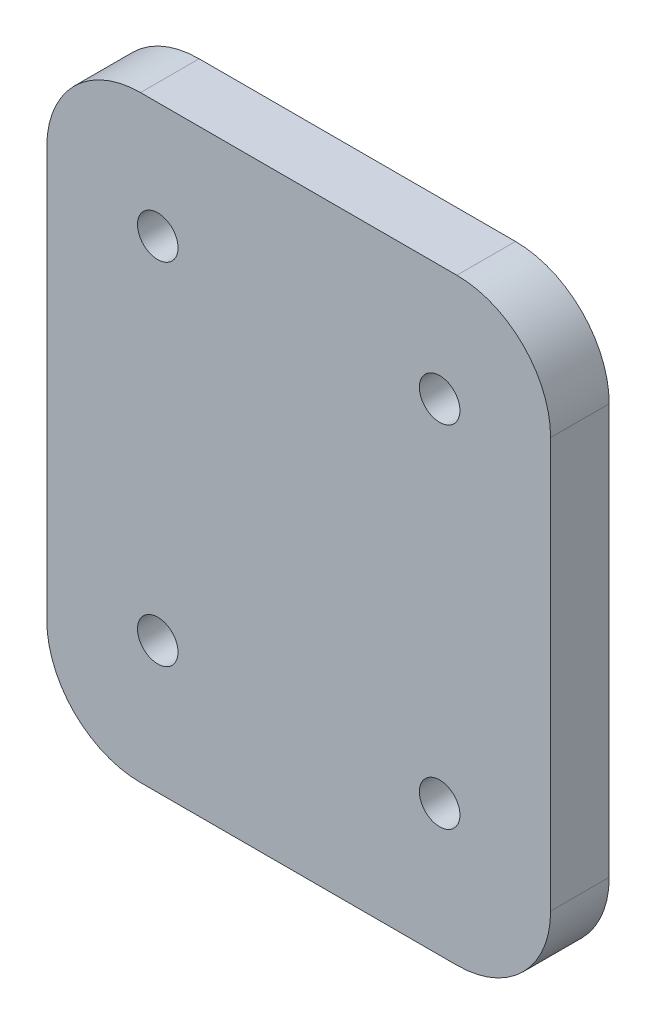
from build123d import *

# Parameters (mm, degrees)
SKETCH1_R           = 1.73
BOSS_EXTRUDE1_DEPTH = 5


with BuildPart() as part:
    # Sketch1 → Boss-Extrude1 (new body)
    with BuildSketch(Plane.XY):
        with BuildLine():
            Line((81.26, -26.226860465), (54.26, -26.226860465))
            ThreePointArc((54.26, -26.226860465), (48.603145751, -23.883714715), (46.26, -18.226860465))
            Line((46.26, -18.226860465), (46.26, 16.773139535))
            ThreePointArc((46.26, 16.773139535), (48.603145751, 22.429993784), (54.26, 24.773139535))
            Line((54.26, 24.773139535), (81.26, 24.773139535))
            ThreePointArc((81.26, 24.773139535), (86.916854249, 22.429993784), (89.26, 16.773139535))
            Line((89.26, 16.773139535), (89.26, -18.226860465))
            ThreePointArc((89.26, -18.226860465), (86.916854249, -23.883714715), (81.26, -26.226860465))
        make_face()
        with Locations((79.79, 14.895)):
            Circle(SKETCH1_R, mode=Mode.SUBTRACT)
        with Locations((55.73, 14.895)):
            Circle(SKETCH1_R, mode=Mode.SUBTRACT)
        with Locations((55.73, -14.995)):
            Circle(SKETCH1_R, mode=Mode.SUBTRACT)
        with Locations((79.79, -14.995)):
            Circle(SKETCH1_R, mode=Mode.SUBTRACT)
    extrude(amount=BOSS_EXTRUDE1_DEPTH)


solid = part.part
